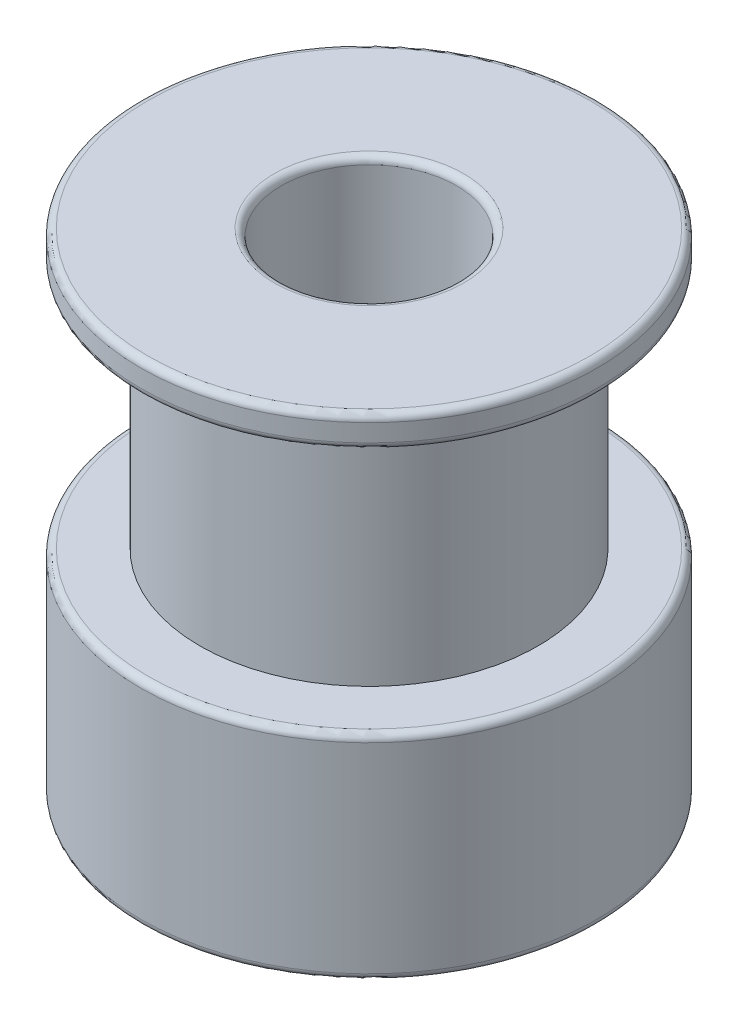
from build123d import *

# Parameters (mm, degrees)
SKETCH1_R               = 6.5
SKETCH1_R_2             = 2.5
BOSS_EXTRUDE1_DEPTH     = 14
CUT_EXTRUDE1_REACH      = 18.748
CUT_EXTRUDE1_END_RADIUS = 6.5
SKETCH2_R               = 1.25
CUT_EXTRUDE2_START      = -7.9
SKETCH3_R               = 6.5
SKETCH3_R_2             = 4.815
CUT_EXTRUDE2_DEPTH      = 7
CUT_EXTRUDE3_REACH      = 18.748
CUT_EXTRUDE3_END_RADIUS = 6.5
SKETCH4_R               = 1.25
FILLET1_R               = 0.2


with BuildPart() as part:
    # Sketch1 → Boss-Extrude1 (new body)
    with BuildSketch(Plane(origin=(0, 0, 0), x_dir=(1, 0, 0), z_dir=(0, 1, 0))):
        with Locations(Location((0, 0, 0), (0, 0, 270))):
            Circle(SKETCH1_R)
        with Locations(Location((0, 0, 0), (0, 0, 270))):
            Circle(SKETCH1_R_2, mode=Mode.SUBTRACT)
    extrude(amount=BOSS_EXTRUDE1_DEPTH)

    # Cut-Extrude1: up to this cylinder (the profile starts inside it)
    cut_extrude1_end = Plane(origin=(0, 3, 0), z_dir=(0, -1, 0)) * Cylinder(CUT_EXTRUDE1_END_RADIUS, 51.496, mode=Mode.PRIVATE)
    # Sketch2 → Cut-Extrude1 (cut, up to the surface)
    with BuildSketch(Plane.XY, mode=Mode.PRIVATE) as cut_extrude1_sk1:
        with Locations((0, 3)):
            Circle(SKETCH2_R)
    cut_extrude1_tool1 = extrude(cut_extrude1_sk1.sketch, amount=-CUT_EXTRUDE1_REACH, mode=Mode.PRIVATE) & cut_extrude1_end
    add(cut_extrude1_tool1.solids().sort_by_distance((0, 3, 0))[0], mode=Mode.SUBTRACT)

    # Sketch3 → Cut-Extrude2 (cut)
    with BuildSketch(Plane(origin=(0, 14, 0), x_dir=(1, 0, 0), z_dir=(0, 1, 0)).offset(CUT_EXTRUDE2_START)):
        with Locations(Location((0, 0, 0), (0, 0, 270))):
            Circle(SKETCH3_R)
        with Locations(Location((0, 0, 0), (0, 0, 270))):
            Circle(SKETCH3_R_2, mode=Mode.SUBTRACT)
    extrude(amount=CUT_EXTRUDE2_DEPTH, mode=Mode.SUBTRACT)

    # Cut-Extrude3: up to this cylinder (the profile starts inside it)
    cut_extrude3_end = Plane(origin=(0, 3, 0), z_dir=(0, -1, 0)) * Cylinder(CUT_EXTRUDE3_END_RADIUS, 51.496, mode=Mode.PRIVATE)
    # Sketch4 → Cut-Extrude3 (cut, up to the surface)
    with BuildSketch(Plane(origin=(0, 0, 0), x_dir=(0, 0, -1), z_dir=(1, 0, 0)), mode=Mode.PRIVATE) as cut_extrude3_sk1:
        with Locations((0, 3)):
            Circle(SKETCH4_R)
    cut_extrude3_tool1 = extrude(cut_extrude3_sk1.sketch, amount=-CUT_EXTRUDE3_REACH, mode=Mode.PRIVATE) & cut_extrude3_end
    add(cut_extrude3_tool1.solids().sort_by_distance((0, 3, 0))[0], mode=Mode.SUBTRACT)

    # Fillet1
    fillet1_edges = [part.edges().sort_by_distance(p)[0] for p in [
        (-1.25, 3, -6.378675411),
        (0, 6.1, -6.5),
        (0, 13.1, -6.5),
        (0, 0, -6.5),
        (-6.378675413, 2.999999999, 1.250000005),
        (0, 14, -6.5),
        (0, 14, -2.5),
    ]]
    fillet(fillet1_edges, radius=FILLET1_R)


solid = part.part
